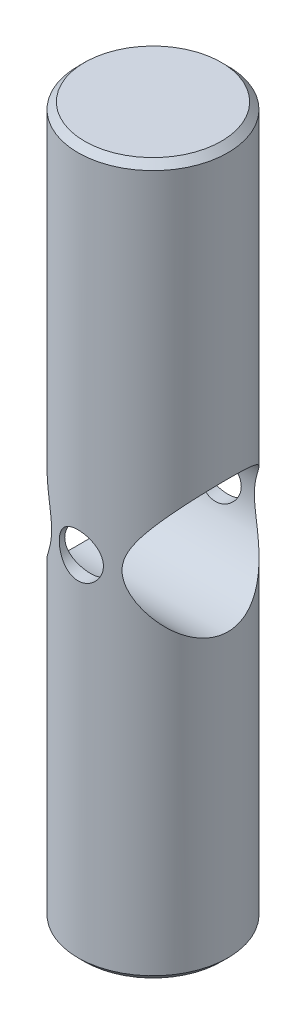
from build123d import *

# Parameters (mm, degrees)
SKETCH1_R               = 8.495
BOSS_EXTRUDE1_DEPTH     = 80.5
CHAMFER1_SIZE           = 0.75
CUT_EXTRUDE1_DEPTH      = 82.391523207
CUT_EXTRUDE1_DEPTH_BACK = 82.391523207
SKETCH2_R               = 7.5
CUT_EXTRUDE2_DEPTH      = 82.391523228
CUT_EXTRUDE2_DEPTH_BACK = 82.391523228
SKETCH3_R               = 2.5


with BuildPart() as part:
    # Sketch1 → Boss-Extrude1 (new body)
    with BuildSketch(Plane(origin=(0, 0, 0), x_dir=(1, 0, 0), z_dir=(0, 1, 0))):
        with Locations(Location((0, 0, 0), (0, 0, 270))):
            Circle(SKETCH1_R)
    extrude(amount=BOSS_EXTRUDE1_DEPTH)

    # Chamfer1
    chamfer1_edges = [part.edges().sort_by_distance(p)[0] for p in [
        (0, 0, -8.495),
        (0, 80.5, -8.495),
    ]]
    chamfer(chamfer1_edges, length=CHAMFER1_SIZE)

    # Sketch2 → Cut-Extrude1 (cut, two sides: drawn at the far end of the back side and taken through both)
    with BuildSketch(Plane(origin=(0, 0, 0), x_dir=(0, 0, -1), z_dir=(1, 0, 0)).offset(-CUT_EXTRUDE1_DEPTH_BACK)):
        with Locations((0, 40.25)):
            Circle(SKETCH2_R)
    extrude(amount=CUT_EXTRUDE1_DEPTH + CUT_EXTRUDE1_DEPTH_BACK, mode=Mode.SUBTRACT)

    # Sketch3 → Cut-Extrude2 (cut, two sides: drawn at the far end of the back side and taken through both)
    with BuildSketch(Plane.XY.offset(-CUT_EXTRUDE2_DEPTH_BACK)):
        with Locations((0, 40.25)):
            Circle(SKETCH3_R)
    extrude(amount=CUT_EXTRUDE2_DEPTH + CUT_EXTRUDE2_DEPTH_BACK, mode=Mode.SUBTRACT)


solid = part.part
